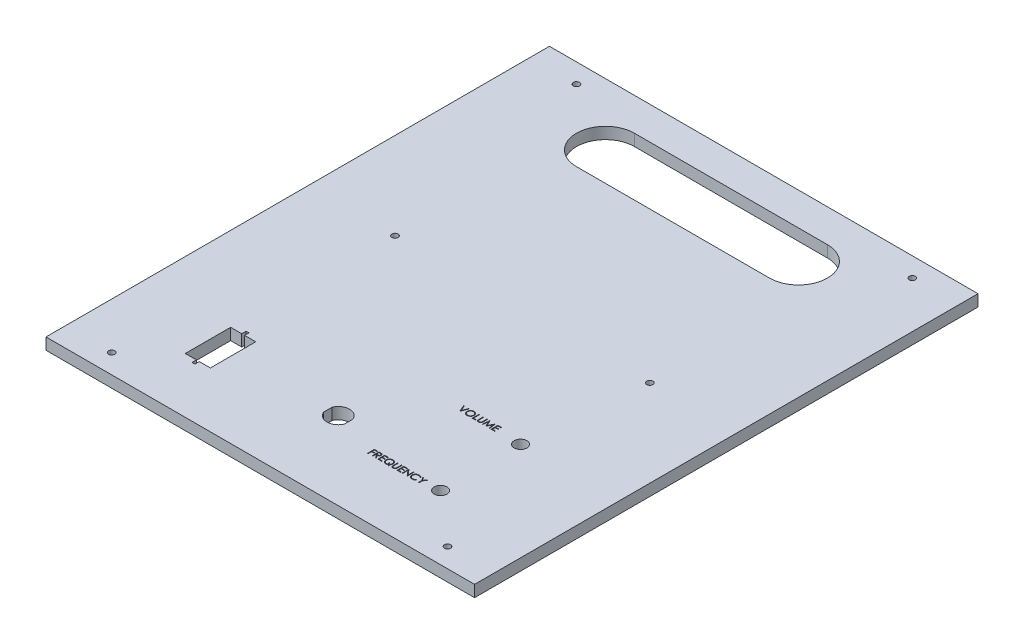
from build123d import *

# Parameters (mm, degrees)
BOSS_EXTRUDE1_DEPTH = 6
SKETCH3_R           = 1.6
SKETCH3_W           = 222
SKETCH3_H           = 30.425305758
CUT_EXTRUDE1_DEPTH  = 10
SKETCH4_R           = 1.6
CUT_EXTRUDE2_DEPTH  = 10
CUT_EXTRUDE3_DEPTH  = 10
SKETCH6_R           = 3.3
CUT_EXTRUDE4_DEPTH  = 10
CUT_EXTRUDE5_DEPTH  = 1
CUT_EXTRUDE6_DEPTH  = 10
SKETCH12_W          = 13
SKETCH12_H          = 23.5
CUT_EXTRUDE7_DEPTH  = 10
SKETCH13_W          = 1.5
SKETCH13_H          = 28
CUT_EXTRUDE8_DEPTH  = 10


with BuildPart() as part:
    # Sketch1 → Boss-Extrude1 (new body)
    with BuildSketch(Plane(origin=(0, 0, 0), x_dir=(1, 0, 0), z_dir=(0, 1, 0))):
        Polygon((-111, 125.612652879), (111, 125.612652879), (111, -125.612652879), (111, -165.612652879), (-111, -165.612652879), (-111, -125.612652879), align=None)
    extrude(amount=BOSS_EXTRUDE1_DEPTH)

    # Sketch3 → Cut-Extrude1 (cut)
    with BuildSketch(Plane.XZ):
        with Locations(Location((-66, 29.812652879, 0), (0, 0, 270))):
            Circle(SKETCH3_R)
        with Locations(Location((66, 29.812652879, 0), (0, 0, 270))):
            Circle(SKETCH3_R)
        with Locations((0, -110.4)):
            Rectangle(SKETCH3_W, SKETCH3_H)
    extrude(amount=-CUT_EXTRUDE1_DEPTH, mode=Mode.SUBTRACT)

    # Sketch4 → Cut-Extrude2 (cut)
    with BuildSketch(Plane.XZ):
        with Locations(Location((87, 155.612652879, 0), (0, 0, 270))):
            Circle(SKETCH4_R)
        with Locations(Location((-87, 155.612652879, 0), (0, 0, 270))):
            Circle(SKETCH4_R)
        with Locations(Location((-87, -85.187347121, 0), (0, 0, 270))):
            Circle(SKETCH4_R)
        with Locations(Location((87, -85.187347121, 0), (0, 0, 270))):
            Circle(SKETCH4_R)
    extrude(amount=-CUT_EXTRUDE2_DEPTH, mode=Mode.SUBTRACT)

    # Sketch5 → Cut-Extrude3 (cut)
    with BuildSketch(Plane(origin=(0, 0, 0), x_dir=(-1, 0, 0), z_dir=(0, -1, 0))):
        with BuildLine():
            Line((-5.375, -123.020074488), (-5.375, -127.40523127))
            ThreePointArc((-5.375, -127.40523127), (0, -131.017652879), (5.375, -127.40523127))
            Line((5.375, -127.40523127), (5.375, -123.020074488))
            ThreePointArc((5.375, -123.020074488), (0, -119.407652879), (-5.375, -123.020074488))
        make_face()
    extrude(amount=-CUT_EXTRUDE3_DEPTH, mode=Mode.SUBTRACT)

    # Sketch6 → Cut-Extrude4 (cut)
    with BuildSketch(Plane.XZ):
        with Locations(Location((60.087916792, 90.868161769, 0), (0, 0, 270))):
            Circle(SKETCH6_R)
        with Locations(Location((60.087916792, 132.307451464, 0), (0, 0, 270))):
            Circle(SKETCH6_R)
    extrude(amount=-CUT_EXTRUDE4_DEPTH, mode=Mode.SUBTRACT)

    # Sketch10 → Cut-Extrude5 (cut)
    # profile 1 of 15: a face of its own
    with BuildSketch(Plane(origin=(0, 6, 0), x_dir=(1, 0, 0), z_dir=(0, 1, 0))):
        Polygon((27.998808243, -88.209916027), (28.335346705, -88.209916027), (29.502013372, -90.968129168), (30.668680038, -88.209916027), (31.0052185, -88.209916027), (29.524449269, -91.709916027), (29.479577474, -91.709916027), align=None)
    # profile 2 of 15: a face of its own
    with BuildSketch(Plane(origin=(0, 6, 0), x_dir=(1, 0, 0), z_dir=(0, 1, 0))):
        with BuildLine():
            add(Edge.make_bspline(
                [(33.271244141, -88.120172438), (33.336052247, -88.121813917), (33.463340714, -88.125037918), (33.650415611, -88.149717021), (33.829010707, -88.192412411), (34.000580846, -88.249275394), (34.163073822, -88.325129779), (34.317712715, -88.416814928), (34.464129588, -88.525291386), (34.60035097, -88.649720613), (34.72500792, -88.785104067), (34.834833807, -88.929581977), (34.9268761, -89.08228078), (35.002461887, -89.24274161), (35.061760497, -89.410601578), (35.102679541, -89.586755581), (35.128817691, -89.770062271), (35.131873468, -89.895089136), (35.133423628, -89.958513784)],
                knots=[0, 0, 0, 0, 1.065120563, 2.091984664, 3.0946048, 4.079830382, 5.057816894, 6.036188127, 7.030412546, 8.04752943, 9.064399622, 10.05169764, 11.02544977, 11.989514704, 12.962713494, 13.945757189, 14.957906945, 16, 16, 16, 16], degree=3))
            add(Edge.make_bspline(
                [(35.133423628, -89.958513784), (35.131873696, -90.02147123), (35.128818599, -90.145567651), (35.102649821, -90.327711095), (35.061608821, -90.502801791), (35.003012555, -90.670547444), (34.927787077, -90.831125008), (34.835131906, -90.984111962), (34.725990695, -91.12955846), (34.601783844, -91.265871125), (34.466382802, -91.390868596), (34.321152535, -91.499787472), (34.169359215, -91.593511596), (34.009049507, -91.66829527), (33.84234947, -91.728067191), (33.667767147, -91.768819821), (33.486120593, -91.795106864), (33.362249589, -91.79812538), (33.299289013, -91.799659617)],
                knots=[0, 0, 0, 0, 1.043624062, 2.057103931, 3.04512605, 4.022047818, 4.998200453, 5.980619268, 6.982898556, 8.009068085, 9.034988726, 10.034168286, 11.015286542, 11.987931943, 12.962482838, 13.94673481, 14.956375938, 16, 16, 16, 16], degree=3))
            add(Edge.make_bspline(
                [(33.299289013, -91.799659617), (33.235864694, -91.79811023), (33.110838478, -91.795055976), (32.927301442, -91.768874572), (32.751023699, -91.727933268), (32.582509347, -91.669423831), (32.421664418, -91.593806601), (32.268174335, -91.501602222), (32.122655188, -91.392195081), (31.986313441, -91.268028506), (31.861564243, -91.132856954), (31.752804867, -90.988022699), (31.660579754, -90.836367242), (31.585216422, -90.677469718), (31.525551962, -90.512098275), (31.484847144, -90.339149798), (31.458511192, -90.159610292), (31.455476346, -90.037367394), (31.453936449, -89.975340707)],
                knots=[0, 0, 0, 0, 1.053102029, 2.075944431, 3.073151272, 4.055350789, 5.033113405, 6.020478099, 7.024410459, 8.052272461, 9.079885166, 10.07527673, 11.055994387, 12.023226415, 12.992069828, 13.970394897, 14.97016774, 16, 16, 16, 16], degree=3))
            add(Edge.make_bspline(
                [(31.453936449, -89.975340707), (31.454471084, -89.933708038), (31.45553361, -89.850967914), (31.468325303, -89.728101314), (31.486887004, -89.607210656), (31.513488917, -89.488639708), (31.548280584, -89.372678724), (31.589332611, -89.258527961), (31.639472456, -89.147344237), (31.696153104, -89.038600845), (31.759414912, -88.933992939), (31.829290662, -88.835113356), (31.90332603, -88.74113236), (31.984489424, -88.654485356), (32.070105869, -88.572651699), (32.161564247, -88.496888982), (32.258306492, -88.426514031), (32.360748871, -88.36309369), (32.466367146, -88.305734556), (32.575243924, -88.256512705), (32.685900496, -88.214266643), (32.798855144, -88.180025818), (32.913807916, -88.152993782), (33.0310097, -88.134586428), (33.150367126, -88.12176211), (33.230778445, -88.120704608), (33.271244141, -88.120172438)],
                knots=[0, 0, 0, 0, 1.037015668, 2.060948919, 3.074880161, 4.083647147, 5.086022904, 6.090072063, 7.104153813, 8.122640571, 9.144368836, 10.147691507, 11.138137339, 12.123020368, 13.103399296, 14.087645067, 15.080126199, 16.082011238, 17.087798457, 18.072939717, 19.057185487, 20.037253025, 21.01195951, 21.997135196, 22.992090687, 24, 24, 24, 24], degree=3))
        make_face()
        with BuildLine():
            add(Edge.make_bspline(
                [(33.28666882, -88.479146797), (33.253454187, -88.479551687), (33.187342454, -88.480357597), (33.089057918, -88.490973312), (32.992065984, -88.506103201), (32.896346622, -88.527684722), (32.802300332, -88.557088775), (32.709050491, -88.590929683), (32.617447437, -88.632150773), (32.527793579, -88.678723478), (32.440878504, -88.730272399), (32.358865803, -88.787244166), (32.281543159, -88.84830272), (32.209099892, -88.913590557), (32.14174872, -88.983440159), (32.078164019, -89.056792595), (32.020894437, -89.135744486), (31.96840886, -89.218154893), (31.92144102, -89.303916474), (31.879675665, -89.392126337), (31.845511656, -89.483504023), (31.81764928, -89.577058181), (31.794549469, -89.672640641), (31.779915545, -89.770976489), (31.769183186, -89.871571601), (31.76842334, -89.939553455), (31.768039013, -89.973938463)],
                knots=[0, 0, 0, 0, 1.008559885, 2.007477868, 2.99961109, 3.989939068, 4.984837346, 5.991145699, 7.001802488, 8.033829008, 9.059044045, 10.069351652, 11.065060232, 12.050310815, 13.029377138, 14.011219647, 14.996725999, 15.989392538, 16.977580475, 17.965360261, 18.951710183, 19.937753436, 20.929683414, 21.935841486, 22.955955122, 24, 24, 24, 24], degree=3))
            add(Edge.make_bspline(
                [(31.768039013, -89.973938463), (31.769313875, -90.024500684), (31.771821922, -90.123972214), (31.793779493, -90.269740358), (31.827601467, -90.409828645), (31.877458833, -90.543470554), (31.939809448, -90.671814837), (32.016836338, -90.793722941), (32.108095424, -90.909227816), (32.211758951, -91.017523085), (32.325081657, -91.116368889), (32.445414387, -91.203132298), (32.571467995, -91.276542547), (32.703571197, -91.33634762), (32.841018736, -91.383737358), (32.984696287, -91.416215989), (33.133646747, -91.437591444), (33.235177402, -91.4396442), (33.28666882, -91.440685258)],
                knots=[0, 0, 0, 0, 1.032063989, 2.030389145, 3.003944642, 3.970395727, 4.937377036, 5.913328081, 6.909231446, 7.93887556, 8.970685674, 9.976071282, 10.964166581, 11.944589148, 12.933237628, 13.927779006, 14.949070134, 16, 16, 16, 16], degree=3))
            add(Edge.make_bspline(
                [(33.28666882, -91.440685258), (33.321278322, -91.440209754), (33.389919358, -91.439266686), (33.492014881, -91.429768009), (33.592271092, -91.41453614), (33.690547372, -91.392605484), (33.786732184, -91.365158277), (33.881226987, -91.33255055), (33.973025277, -91.291869346), (34.063285115, -91.246921394), (34.149681357, -91.195681237), (34.232156889, -91.140643087), (34.308632869, -91.079674466), (34.38102194, -91.015356654), (34.448649629, -90.946392806), (34.511058613, -90.872872584), (34.568038746, -90.794331927), (34.620504392, -90.712046521), (34.667307655, -90.626050268), (34.708086754, -90.537520591), (34.74268287, -90.446675481), (34.770611375, -90.35338391), (34.792496836, -90.257823061), (34.807576756, -90.159864983), (34.818125195, -90.05970564), (34.818920272, -89.991961784), (34.819321064, -89.957812662)],
                knots=[0, 0, 0, 0, 1.047197238, 2.076906641, 3.100256066, 4.114471768, 5.12198147, 6.126382909, 7.136867548, 8.15857795, 9.17633901, 10.174870724, 11.156907918, 12.133735059, 13.104061851, 14.077631395, 15.04955518, 16.038496417, 17.029181396, 18.010275684, 18.986308667, 19.968651475, 20.955262928, 21.950658345, 22.966943676, 24, 24, 24, 24], degree=3))
            add(Edge.make_bspline(
                [(34.819321064, -89.957812662), (34.818919951, -89.923897158), (34.818124269, -89.856619508), (34.807581795, -89.757158689), (34.792480905, -89.659905478), (34.770718196, -89.565241675), (34.742668043, -89.47314315), (34.708080712, -89.383696402), (34.667295413, -89.296568207), (34.620487188, -89.21197391), (34.567871365, -89.130799172), (34.510377122, -89.053196759), (34.447011774, -88.980624018), (34.379585749, -88.911289324), (34.306414863, -88.846671434), (34.227830569, -88.786748914), (34.144786892, -88.730075639), (34.056859656, -88.678950078), (33.966115702, -88.631735845), (33.873001744, -88.591284842), (33.778572645, -88.556912722), (33.683068532, -88.527595757), (33.585685554, -88.506187727), (33.487081725, -88.490959677), (33.387393467, -88.480361291), (33.320350247, -88.479552913), (33.28666882, -88.479146797)],
                knots=[0, 0, 0, 0, 1.02996197, 2.043119294, 3.035359645, 4.018872909, 4.991431989, 5.957985074, 6.929999688, 7.912076566, 8.892894881, 9.867085534, 10.843653904, 11.817741046, 12.803660682, 13.806313499, 14.818574707, 15.856120519, 16.894564902, 17.924820532, 18.937903209, 19.946497019, 20.957711757, 21.963978472, 22.977135795, 24, 24, 24, 24], degree=3))
        make_face(mode=Mode.SUBTRACT)
    # profile 3 of 15: a face of its own
    with BuildSketch(Plane(origin=(0, 6, 0), x_dir=(1, 0, 0), z_dir=(0, 1, 0))):
        Polygon((35.851372346, -88.209916027), (36.16547491, -88.209916027), (36.16547491, -91.350941668), (37.511628756, -91.350941668), (37.511628756, -91.709916027), (35.851372346, -91.709916027), align=None)
    # profile 4 of 15: a face of its own
    with BuildSketch(Plane(origin=(0, 6, 0), x_dir=(1, 0, 0), z_dir=(0, 1, 0))):
        with BuildLine():
            Line((38.09496209, -88.209916027), (38.409064654, -88.209916027))
            Line((38.409064654, -88.209916027), (38.409064654, -90.306971316))
            add(Edge.make_bspline(
                [(38.409064654, -90.306971316), (38.40901791, -90.336652052), (38.408929205, -90.392976363), (38.409521719, -90.473144663), (38.411181087, -90.544417122), (38.412227247, -90.60706847), (38.41455458, -90.660811217), (38.416452627, -90.705936528), (38.418893184, -90.74223073), (38.421826301, -90.763411656), (38.42308709, -90.772516188)],
                knots=[0, 0, 0, 0, 1.528628734, 2.90083645, 4.128790002, 5.200304208, 6.127813768, 6.898992206, 7.526736466, 8, 8, 8, 8], degree=3))
            add(Edge.make_bspline(
                [(38.42308709, -90.772516188), (38.428264548, -90.805362951), (38.438327735, -90.86920568), (38.463974113, -90.960113962), (38.499791614, -91.04204542), (38.542234656, -91.117556711), (38.598167268, -91.184546071), (38.665170803, -91.246257724), (38.746348571, -91.300229529), (38.836609177, -91.349580341), (38.933894415, -91.389245423), (39.033305681, -91.419238787), (39.13334866, -91.437517687), (39.200324825, -91.439634226), (39.233583884, -91.440685258)],
                knots=[0, 0, 0, 0, 1.035780045, 2.013197591, 2.933192213, 3.817615948, 4.702609284, 5.640816605, 6.646850145, 7.73207398, 8.84249596, 9.914020372, 10.964143139, 12, 12, 12, 12], degree=3))
            add(Edge.make_bspline(
                [(39.233583884, -91.440685258), (39.262137625, -91.439611408), (39.319080187, -91.43746991), (39.403686617, -91.424208479), (39.486086726, -91.400307913), (39.566687406, -91.369468154), (39.64223839, -91.328720563), (39.712781832, -91.281649724), (39.775745767, -91.226438848), (39.833203764, -91.165338503), (39.8832387, -91.096398703), (39.926609842, -91.021120565), (39.962135772, -90.938371218), (39.979679296, -90.880216796), (39.988692058, -90.850340707)],
                knots=[0, 0, 0, 0, 0.994687771, 1.983630487, 2.973142513, 3.978332533, 4.983357753, 5.956394766, 6.925816176, 7.893390482, 8.871859704, 9.88551698, 10.913711441, 12, 12, 12, 12], degree=3))
            add(Edge.make_bspline(
                [(39.988692058, -90.850340707), (39.991692183, -90.837992132), (39.998377671, -90.810474532), (40.004624716, -90.763953242), (40.011131241, -90.709063878), (40.015645811, -90.645412065), (40.020047032, -90.573211092), (40.022680105, -90.492084835), (40.023897138, -90.402327874), (40.024259818, -90.339690712), (40.024449269, -90.306971316)],
                knots=[0, 0, 0, 0, 0.558680831, 1.244966039, 2.062412453, 2.990489873, 4.051219941, 5.244515665, 6.560634259, 8, 8, 8, 8], degree=3))
            Line((40.024449269, -90.306971316), (40.024449269, -88.209916027))
            Line((40.024449269, -88.209916027), (40.338551833, -88.209916027))
            Line((40.338551833, -88.209916027), (40.338551833, -90.323798239))
            add(Edge.make_bspline(
                [(40.338551833, -90.323798239), (40.338297713, -90.361896618), (40.337801781, -90.436247921), (40.333501205, -90.54519928), (40.326644205, -90.648552261), (40.316956117, -90.746320758), (40.304119114, -90.838154917), (40.289843893, -90.924859685), (40.27166436, -91.005812678), (40.250430959, -91.081645095), (40.226157411, -91.153830609), (40.194716263, -91.222339223), (40.159291763, -91.289253623), (40.11727711, -91.353561732), (40.070065727, -91.415548285), (40.016614047, -91.47483736), (39.958689886, -91.532376406), (39.895330326, -91.586689472), (39.827579801, -91.636498149), (39.755639843, -91.68029592), (39.680063073, -91.717319538), (39.601045947, -91.747795462), (39.518554744, -91.770710062), (39.432587385, -91.787785217), (39.342948191, -91.797487515), (39.281983535, -91.798929445), (39.251111929, -91.799659617)],
                knots=[0, 0, 0, 0, 1.316592851, 2.569410997, 3.76748051, 4.895814652, 5.963796859, 6.97159953, 7.931736103, 8.829262218, 9.692595152, 10.560224239, 11.431080259, 12.30701507, 13.211635791, 14.121146779, 15.063487852, 16.031507147, 17.00238618, 17.966455255, 18.938106653, 19.907068911, 20.888905087, 21.893141452, 22.933117798, 24, 24, 24, 24], degree=3))
            add(Edge.make_bspline(
                [(39.251111929, -91.799659617), (39.217442827, -91.798874852), (39.151384168, -91.797335145), (39.054046101, -91.788512395), (38.960731904, -91.771894001), (38.870456027, -91.750734057), (38.78444753, -91.72155032), (38.701554086, -91.687452195), (38.623195405, -91.645574935), (38.548100276, -91.598981542), (38.47827552, -91.546556903), (38.414178117, -91.489416729), (38.355702246, -91.428476352), (38.30383355, -91.363075986), (38.257712665, -91.293724279), (38.217982452, -91.220225039), (38.183869208, -91.142606723), (38.166262641, -91.088653523), (38.157361929, -91.061378367)],
                knots=[0, 0, 0, 0, 1.13879206, 2.234305948, 3.301075583, 4.341971843, 5.366689343, 6.369221514, 7.369726634, 8.367512178, 9.355451585, 10.318319045, 11.268648973, 12.207971039, 13.137398894, 14.081662264, 15.030215811, 16, 16, 16, 16], degree=3))
            add(Edge.make_bspline(
                [(38.157361929, -91.061378367), (38.152184771, -91.042745793), (38.1409554, -91.002331324), (38.128930102, -90.935444835), (38.118821021, -90.858429918), (38.109315462, -90.771281299), (38.103706504, -90.673931433), (38.098789066, -90.566422517), (38.094927447, -90.448624555), (38.094950219, -90.366570039), (38.09496209, -90.323798239)],
                knots=[0, 0, 0, 0, 0.625038921, 1.35572334, 2.194682327, 3.136881307, 4.189498639, 5.346923369, 6.617055217, 8, 8, 8, 8], degree=3))
            Line((38.09496209, -90.323798239), (38.09496209, -88.209916027))
        make_face()
    # profile 5 of 15: a face of its own
    with BuildSketch(Plane(origin=(0, 6, 0), x_dir=(1, 0, 0), z_dir=(0, 1, 0))):
        Polygon((41.056500551, -91.709916027), (41.518539814, -88.209916027), (41.563411609, -88.209916027), (43.008423628, -91.081710899), (44.449930038, -88.209916027), (44.495502955, -88.209916027), (44.960346705, -91.709916027), (44.644841897, -91.709916027), (44.309705679, -89.19148654), (43.046284205, -91.709916027), (42.975470904, -91.709916027), (41.707141577, -89.185877566), (41.372706481, -91.709916027), align=None)
    # profile 6 of 15: a face of its own
    with BuildSketch(Plane(origin=(0, 6, 0), x_dir=(1, 0, 0), z_dir=(0, 1, 0))):
        Polygon((45.678295423, -88.209916027), (47.652654397, -88.209916027), (47.652654397, -88.568890386), (45.992397987, -88.568890386), (45.992397987, -89.645813463), (47.652654397, -89.645813463), (47.652654397, -90.004787822), (45.992397987, -90.004787822), (45.992397987, -91.350941668), (47.652654397, -91.350941668), (47.652654397, -91.709916027), (45.678295423, -91.709916027), align=None)
    # profile 7 of 15: a face of its own
    with BuildSketch(Plane(origin=(0, 6, 0), x_dir=(1, 0, 0), z_dir=(0, 1, 0))):
        Polygon((24.47349917, -130.972883793), (26.178627375, -130.972883793), (26.178627375, -131.331858152), (24.787601734, -131.331858152), (24.787601734, -132.408781229), (26.178627375, -132.408781229), (26.178627375, -132.767755588), (24.787601734, -132.767755588), (24.787601734, -134.472883793), (24.47349917, -134.472883793), align=None)
    # profile 8 of 15: a face of its own
    with BuildSketch(Plane(origin=(0, 6, 0), x_dir=(1, 0, 0), z_dir=(0, 1, 0))):
        with BuildLine():
            Line((26.806832503, -130.972883793), (27.507253176, -130.972883793))
            add(Edge.make_bspline(
                [(27.507253176, -130.972883793), (27.553994305, -130.973039379), (27.643742449, -130.973338121), (27.77231572, -130.975003884), (27.889142817, -130.97977824), (27.994162656, -130.983886823), (28.087373311, -130.991378764), (28.169060602, -130.998539412), (28.238848299, -131.007913072), (28.28109415, -131.016618495), (28.300221926, -131.020560075)],
                knots=[0, 0, 0, 0, 1.410062039, 2.707475311, 3.878576406, 4.937260626, 5.877586885, 6.699081471, 7.410979367, 8, 8, 8, 8], degree=3))
            add(Edge.make_bspline(
                [(28.300221926, -131.020560075), (28.32582855, -131.02688684), (28.37649554, -131.039405404), (28.449445606, -131.065865005), (28.51895993, -131.096484629), (28.584749754, -131.13244835), (28.646485545, -131.174023129), (28.704803856, -131.220491252), (28.75996932, -131.271598457), (28.80975095, -131.328633299), (28.856690001, -131.388469809), (28.896278628, -131.453173565), (28.930405108, -131.520835093), (28.957575625, -131.592142511), (28.979453598, -131.666404283), (28.994879837, -131.744293079), (29.004131025, -131.825454054), (29.005072881, -131.880811963), (29.005550452, -131.908881389)],
                knots=[0, 0, 0, 0, 1.027469482, 2.033020251, 3.019912614, 3.986113645, 4.951240523, 5.91722682, 6.890402269, 7.87763091, 8.8651537, 9.85103654, 10.82876324, 11.815024772, 12.821070561, 13.842952187, 14.906261191, 16, 16, 16, 16], degree=3))
            add(Edge.make_bspline(
                [(29.005550452, -131.908881389), (29.004081454, -131.955516494), (29.001215058, -132.046513661), (28.974489954, -132.178574543), (28.930713435, -132.301763857), (28.870390146, -132.415926495), (28.79357067, -132.518837141), (28.701245879, -132.609227596), (28.593364267, -132.684867509), (28.492934951, -132.737320313), (28.404220752, -132.770913222), (28.331187439, -132.794549581), (28.251520461, -132.812811546), (28.165983127, -132.829171678), (28.074219471, -132.841523372), (27.976449432, -132.850569967), (27.87260328, -132.856224015), (27.801264211, -132.85706602), (27.764564875, -132.857499177)],
                knots=[0, 0, 0, 0, 1.260483769, 2.459530307, 3.627416485, 4.787058657, 5.939039949, 7.08810263, 8.267026773, 9.491475466, 10.141966685, 10.831826277, 11.566392101, 12.351337768, 13.187381173, 14.07005841, 15.007169909, 16, 16, 16, 16], degree=3))
            Line((27.764564875, -132.857499177), (29.050422247, -134.472883793))
            Line((29.050422247, -134.472883793), (28.662000772, -134.472883793))
            Line((28.662000772, -134.472883793), (27.376143401, -132.857499177))
            Line((27.376143401, -132.857499177), (27.120935067, -132.857499177))
            Line((27.120935067, -132.857499177), (27.120935067, -134.472883793))
            Line((27.120935067, -134.472883793), (26.806832503, -134.472883793))
            Line((26.806832503, -134.472883793), (26.806832503, -130.972883793))
        make_face()
        with BuildLine():
            Line((27.120935067, -131.331858152), (27.120935067, -132.498524818))
            Line((27.120935067, -132.498524818), (27.761760388, -132.503432671))
            add(Edge.make_bspline(
                [(27.761760388, -132.503432671), (27.791680427, -132.503445908), (27.849673984, -132.503471564), (27.933574649, -132.499477788), (28.01169476, -132.49493447), (28.083735513, -132.487985124), (28.149729088, -132.479029052), (28.209642501, -132.467826068), (28.263573553, -132.454774005), (28.326472091, -132.43457238), (28.396708623, -132.402566361), (28.473040083, -132.356000863), (28.53804242, -132.297431743), (28.592960283, -132.230458287), (28.637089714, -132.156822039), (28.668201768, -132.077405669), (28.687944211, -131.994214071), (28.690272756, -131.937035964), (28.691447888, -131.908180267)],
                knots=[0, 0, 0, 0, 1.146690395, 2.22261258, 3.21895312, 4.145990853, 4.996080663, 5.770904154, 6.481378293, 7.121626537, 8.300444488, 9.431385265, 10.535395872, 11.636531494, 12.74115979, 13.810798291, 14.895190096, 16, 16, 16, 16], degree=3))
            add(Edge.make_bspline(
                [(28.691447888, -131.908180267), (28.690245767, -131.880033693), (28.687863601, -131.824257455), (28.668414833, -131.742601544), (28.635525451, -131.665534594), (28.591203214, -131.593370109), (28.537204059, -131.527864373), (28.473886246, -131.47181722), (28.402981051, -131.425567756), (28.336709852, -131.396013375), (28.27747564, -131.377893522), (28.22604598, -131.365142358), (28.167934502, -131.354897889), (28.102859044, -131.346689828), (28.031097413, -131.339634884), (27.952286762, -131.334883105), (27.866949981, -131.332069241), (27.80780305, -131.331930152), (27.777185067, -131.331858152)],
                knots=[0, 0, 0, 0, 1.101028733, 2.181837193, 3.264309656, 4.369019818, 5.486613113, 6.575447106, 7.666700264, 8.788928104, 9.402425223, 10.0903467, 10.862060571, 11.710948788, 12.657782767, 13.684531032, 14.801375019, 16, 16, 16, 16], degree=3))
            Line((27.777185067, -131.331858152), (27.120935067, -131.331858152))
        make_face(mode=Mode.SUBTRACT)
    # profile 9 of 15: a face of its own
    with BuildSketch(Plane(origin=(0, 6, 0), x_dir=(1, 0, 0), z_dir=(0, 1, 0))):
        Polygon((29.768370965, -130.972883793), (31.742729939, -130.972883793), (31.742729939, -131.331858152), (30.082473529, -131.331858152), (30.082473529, -132.408781229), (31.742729939, -132.408781229), (31.742729939, -132.767755588), (30.082473529, -132.767755588), (30.082473529, -134.113909434), (31.742729939, -134.113909434), (31.742729939, -134.472883793), (29.768370965, -134.472883793), align=None)
    # profile 10 of 15: a face of its own
    with BuildSketch(Plane(origin=(0, 6, 0), x_dir=(1, 0, 0), z_dir=(0, 1, 0))):
        with BuildLine():
            Line((35.288302856, -134.083060075), (35.826063272, -134.742114562))
            Line((35.826063272, -134.742114562), (35.434136189, -134.742114562))
            Line((35.434136189, -134.742114562), (35.045714715, -134.266753985))
            add(Edge.make_bspline(
                [(35.045714715, -134.266753985), (35.006757622, -134.290427721), (34.929561058, -134.337339103), (34.80919442, -134.397805269), (34.68643412, -134.448121007), (34.561551777, -134.489690981), (34.434729288, -134.522965307), (34.30532355, -134.546059096), (34.173803906, -134.559469372), (34.085441504, -134.561570699), (34.041007183, -134.562627383)],
                knots=[0, 0, 0, 0, 1.030216282, 2.041455142, 3.041201647, 4.026904037, 5.014869161, 6.002481075, 6.995518502, 8, 8, 8, 8], degree=3))
            add(Edge.make_bspline(
                [(34.041007183, -134.562627383), (33.977346842, -134.561094036), (33.852082242, -134.558076867), (33.668112125, -134.53173641), (33.491528506, -134.491055891), (33.322683355, -134.432195226), (33.161392743, -134.357012744), (33.007731605, -134.264323468), (32.86162184, -134.155411253), (32.725220249, -134.030987873), (32.600494832, -133.895632567), (32.491056093, -133.751011529), (32.398003597, -133.599524569), (32.322765111, -133.440416271), (32.263053316, -133.275071784), (32.222361347, -133.102115989), (32.19602191, -132.922578468), (32.192987542, -132.800335298), (32.191447888, -132.738308472)],
                knots=[0, 0, 0, 0, 1.055750571, 2.07740284, 3.077223765, 4.05828044, 5.038417088, 6.02463293, 7.030503776, 8.057169806, 9.083586829, 10.080154041, 11.061747002, 12.027853603, 12.995569715, 13.972756451, 14.971366004, 16, 16, 16, 16], degree=3))
            add(Edge.make_bspline(
                [(32.191447888, -132.738308472), (32.19199568, -132.696677189), (32.193087417, -132.613707116), (32.205716568, -132.490819945), (32.224480359, -132.369955814), (32.251021012, -132.251616987), (32.285764941, -132.135318409), (32.327419324, -132.021289404), (32.377889155, -131.909823796), (32.434944073, -131.801149719), (32.498576673, -131.696209058), (32.567893109, -131.596495399), (32.643063905, -131.502991426), (32.724035845, -131.41573992), (32.810485554, -131.334548012), (32.901669634, -131.258078713), (32.999532311, -131.189176764), (33.101490685, -131.125100715), (33.20811653, -131.068754702), (33.317324244, -131.018383168), (33.429930762, -130.977513014), (33.544475004, -130.942686693), (33.661651898, -130.916098784), (33.781370121, -130.897472545), (33.903545451, -130.884721578), (33.986053091, -130.883670546), (34.027685869, -130.883140203)],
                knots=[0, 0, 0, 0, 1.030721839, 2.054201982, 3.056261636, 4.058906239, 5.055198403, 6.060579377, 7.06322398, 8.083343201, 9.098870418, 10.10084648, 11.0888991, 12.067804703, 13.046436456, 14.024708667, 15.012489976, 16.008294399, 17.005242112, 17.997338632, 18.984424362, 19.969624474, 20.960977749, 21.957320355, 22.969278161, 24, 24, 24, 24], degree=3))
            add(Edge.make_bspline(
                [(34.027685869, -130.883140203), (34.091346447, -130.884665851), (34.216379898, -130.887662322), (34.39989426, -130.914006751), (34.575957672, -130.954850513), (34.744444796, -131.013411209), (34.905205414, -131.088783029), (35.058171985, -131.181453622), (35.203581668, -131.290373052), (35.339270516, -131.414804763), (35.463702182, -131.550493604), (35.572621783, -131.695903268), (35.665291751, -131.848869921), (35.740665883, -132.009630233), (35.799217876, -132.178118508), (35.840147302, -132.354403332), (35.866365941, -132.538170251), (35.86939545, -132.663431756), (35.870935067, -132.727090524)],
                knots=[0, 0, 0, 0, 1.050672203, 2.063587442, 3.054842799, 4.031180399, 5.003107577, 5.981273811, 6.979214548, 7.998088659, 9.016962771, 10.014903508, 10.993069742, 11.96499692, 12.941334519, 13.932589877, 14.949327797, 16, 16, 16, 16], degree=3))
            add(Edge.make_bspline(
                [(35.870935067, -132.727090524), (35.869252449, -132.79332789), (35.865943676, -132.92357992), (35.837785448, -133.114580646), (35.792511961, -133.297031332), (35.728308689, -133.470812437), (35.645308368, -133.635892375), (35.545114501, -133.793921959), (35.426520746, -133.944889987), (35.334860691, -134.036518342), (35.288302856, -134.083060075)],
                knots=[0, 0, 0, 0, 1.045660934, 2.056233022, 3.041853582, 4.009978652, 4.97562384, 5.954545411, 6.961031197, 8, 8, 8, 8], degree=3))
        make_face()
        with BuildLine():
            add(Edge.make_bspline(
                [(35.077265196, -133.824346133), (35.115453876, -133.785563159), (35.190572705, -133.709275332), (35.288037908, -133.584167331), (35.37186776, -133.454120099), (35.438982683, -133.317403699), (35.492381754, -133.175730986), (35.529274648, -133.027979401), (35.552374729, -132.874821579), (35.555335653, -132.770642224), (35.556832503, -132.71797594)],
                knots=[0, 0, 0, 0, 1.052210109, 2.069743939, 3.061837814, 4.040478349, 5.010453814, 5.985306305, 6.981502329, 8, 8, 8, 8], degree=3))
            add(Edge.make_bspline(
                [(35.556832503, -132.71797594), (35.556441399, -132.684059507), (35.555668254, -132.617012697), (35.54503753, -132.51779518), (35.529998216, -132.420769011), (35.508225901, -132.326107549), (35.480188508, -132.234002582), (35.445559865, -132.144579145), (35.405014656, -132.057548749), (35.357747801, -131.973452025), (35.305640093, -131.892410861), (35.247637822, -131.81541635), (35.184557402, -131.7428655), (35.117087959, -131.673562705), (35.043928681, -131.608936552), (34.965341946, -131.549014743), (34.88229612, -131.492347188), (34.794380258, -131.441197404), (34.703782989, -131.394173159), (34.611034431, -131.353453074), (34.516913366, -131.31896462), (34.421565546, -131.290998913), (34.32511435, -131.268986341), (34.227390682, -131.253963856), (34.128647253, -131.243344078), (34.062302784, -131.24252475), (34.029088112, -131.242114562)],
                knots=[0, 0, 0, 0, 1.032958288, 2.041976502, 3.037103433, 4.023477888, 4.998866292, 5.968231228, 6.943073582, 7.921783703, 8.90545537, 9.876780072, 10.85618943, 11.833110341, 12.821898168, 13.827467856, 14.842673888, 15.88323808, 16.924703457, 17.951432745, 18.967462636, 19.976958182, 20.977218729, 21.979378626, 22.98839684, 24, 24, 24, 24], degree=3))
            add(Edge.make_bspline(
                [(34.029088112, -131.242114562), (33.995640351, -131.242527612), (33.928830743, -131.243352652), (33.829610597, -131.253905119), (33.731662652, -131.269002878), (33.635417703, -131.290906046), (33.540534911, -131.318926138), (33.447308786, -131.353623093), (33.354928585, -131.39333741), (33.265311283, -131.440331629), (33.178613678, -131.491921251), (33.09615877, -131.548025346), (33.019076545, -131.609203666), (32.946635803, -131.674471246), (32.879017478, -131.744331673), (32.815902309, -131.81832024), (32.758398709, -131.89729544), (32.705714594, -131.979844282), (32.659149874, -132.066056454), (32.617154406, -132.154376484), (32.583044756, -132.245778088), (32.555041458, -132.339529689), (32.532158524, -132.435398215), (32.517409586, -132.533940178), (32.506699119, -132.63454042), (32.505936289, -132.702521575), (32.505550452, -132.736906229)],
                knots=[0, 0, 0, 0, 1.013205451, 2.023808328, 3.020541854, 4.015386314, 5.012622987, 6.016502547, 7.02834558, 8.057881235, 9.080621846, 10.084476421, 11.077781791, 12.060654405, 13.037357686, 14.022218736, 15.005346502, 15.995617173, 16.98763393, 17.973029642, 18.956998942, 19.940662314, 20.93709383, 21.940823471, 22.958474994, 24, 24, 24, 24], degree=3))
            add(Edge.make_bspline(
                [(32.505550452, -132.736906229), (32.506864008, -132.78745914), (32.509448181, -132.886912356), (32.530870324, -133.032926841), (32.566787236, -133.172713331), (32.617036488, -133.306471807), (32.680117531, -133.43497323), (32.758563578, -133.556958712), (32.852039956, -133.67196363), (32.957010413, -133.78077791), (33.072479483, -133.879359289), (33.194887896, -133.966121668), (33.323190558, -134.039731858), (33.457790362, -134.09914387), (33.597683591, -134.146853726), (33.74397456, -134.179154251), (33.895706959, -134.200563908), (33.999098368, -134.202613671), (34.05152401, -134.203653024)],
                knots=[0, 0, 0, 0, 1.022526523, 2.011626, 2.97850031, 3.937665323, 4.897797383, 5.869804095, 6.865337375, 7.89202157, 8.925035373, 9.93268082, 10.923937058, 11.912550332, 12.905497077, 13.90928476, 14.939882052, 16, 16, 16, 16], degree=3))
            add(Edge.make_bspline(
                [(34.05152401, -134.203653024), (34.087542414, -134.203260653), (34.158784273, -134.202484571), (34.263838278, -134.191903953), (34.366321504, -134.177011514), (34.465284929, -134.154361574), (34.56158672, -134.126202716), (34.65465366, -134.091950008), (34.744979433, -134.051343134), (34.802412503, -134.019218319), (34.831171446, -134.00313219)],
                knots=[0, 0, 0, 0, 1.060694673, 2.097979151, 3.107774411, 4.11000626, 5.086069662, 6.061987343, 7.029562652, 8, 8, 8, 8], degree=3))
            Line((34.831171446, -134.00313219), (34.043110548, -133.036986357))
            Line((34.043110548, -133.036986357), (34.435037631, -133.036986357))
            Line((34.435037631, -133.036986357), (35.077265196, -133.824346133))
        make_face(mode=Mode.SUBTRACT)
    # profile 11 of 15: a face of its own
    with BuildSketch(Plane(origin=(0, 6, 0), x_dir=(1, 0, 0), z_dir=(0, 1, 0))):
        with BuildLine():
            Line((36.588883785, -130.972883793), (36.902986349, -130.972883793))
            Line((36.902986349, -130.972883793), (36.902986349, -133.069939081))
            add(Edge.make_bspline(
                [(36.902986349, -133.069939081), (36.902939605, -133.099619817), (36.902850901, -133.155944128), (36.903443415, -133.236112428), (36.905102783, -133.307384887), (36.906148942, -133.370036235), (36.908476276, -133.423778983), (36.910374323, -133.468904293), (36.91281488, -133.505198496), (36.915747997, -133.526379422), (36.917008785, -133.535483953)],
                knots=[0, 0, 0, 0, 1.528628734, 2.90083645, 4.128790002, 5.200304208, 6.127813768, 6.898992206, 7.526736466, 8, 8, 8, 8], degree=3))
            add(Edge.make_bspline(
                [(36.917008785, -133.535483953), (36.922186244, -133.568330716), (36.93224943, -133.632173446), (36.957895808, -133.723081727), (36.993713309, -133.805013186), (37.036156352, -133.880524477), (37.092088963, -133.947513837), (37.159092499, -134.00922549), (37.240270267, -134.063197294), (37.330530873, -134.112548106), (37.42781611, -134.152213188), (37.527227377, -134.182206553), (37.627270356, -134.200485453), (37.694246521, -134.202601991), (37.72750558, -134.203653024)],
                knots=[0, 0, 0, 0, 1.035780045, 2.013197591, 2.933192213, 3.817615948, 4.702609284, 5.640816605, 6.646850145, 7.73207398, 8.84249596, 9.914020372, 10.964143139, 12, 12, 12, 12], degree=3))
            add(Edge.make_bspline(
                [(37.72750558, -134.203653024), (37.756059321, -134.202579173), (37.813001882, -134.200437675), (37.897608313, -134.187176244), (37.980008422, -134.163275678), (38.060609102, -134.13243592), (38.136160086, -134.091688329), (38.206703528, -134.044617489), (38.269667462, -133.989406613), (38.32712546, -133.928306269), (38.377160396, -133.859366469), (38.420531538, -133.784088331), (38.456057467, -133.701338984), (38.473600992, -133.643184562), (38.482613753, -133.613308472)],
                knots=[0, 0, 0, 0, 0.994687771, 1.983630487, 2.973142513, 3.978332533, 4.983357753, 5.956394766, 6.925816176, 7.893390482, 8.871859704, 9.88551698, 10.913711441, 12, 12, 12, 12], degree=3))
            add(Edge.make_bspline(
                [(38.482613753, -133.613308472), (38.485613878, -133.600959898), (38.492299367, -133.573442298), (38.498546412, -133.526921007), (38.505052937, -133.472031643), (38.509567507, -133.40837983), (38.513968728, -133.336178858), (38.5166018, -133.2550526), (38.517818833, -133.16529564), (38.518181514, -133.102658478), (38.518370965, -133.069939081)],
                knots=[0, 0, 0, 0, 0.558680831, 1.244966039, 2.062412453, 2.990489873, 4.051219941, 5.244515665, 6.560634259, 8, 8, 8, 8], degree=3))
            Line((38.518370965, -133.069939081), (38.518370965, -130.972883793))
            Line((38.518370965, -130.972883793), (38.832473529, -130.972883793))
            Line((38.832473529, -130.972883793), (38.832473529, -133.086766004))
            add(Edge.make_bspline(
                [(38.832473529, -133.086766004), (38.832219408, -133.124864383), (38.831723477, -133.199215686), (38.827422901, -133.308167045), (38.820565901, -133.411520026), (38.810877813, -133.509288523), (38.79804081, -133.601122682), (38.783765589, -133.68782745), (38.765586056, -133.768780443), (38.744352655, -133.844612861), (38.720079107, -133.916798374), (38.688637958, -133.985306989), (38.653213459, -134.052221388), (38.611198806, -134.116529497), (38.563987423, -134.17851605), (38.510535742, -134.237805125), (38.452611581, -134.295344172), (38.389252022, -134.349657238), (38.321501496, -134.399465915), (38.249561539, -134.443263686), (38.173984769, -134.480287303), (38.094967643, -134.510763228), (38.01247644, -134.533677827), (37.92650908, -134.550752983), (37.836869887, -134.56045528), (37.775905231, -134.56189721), (37.745033625, -134.562627383)],
                knots=[0, 0, 0, 0, 1.316592851, 2.569410997, 3.76748051, 4.895814652, 5.963796859, 6.97159953, 7.931736103, 8.829262218, 9.692595152, 10.560224239, 11.431080259, 12.30701507, 13.211635791, 14.121146779, 15.063487852, 16.031507147, 17.00238618, 17.966455255, 18.938106653, 19.907068911, 20.888905087, 21.893141452, 22.933117798, 24, 24, 24, 24], degree=3))
            add(Edge.make_bspline(
                [(37.745033625, -134.562627383), (37.711364522, -134.561842617), (37.645305864, -134.560302911), (37.547967796, -134.55148016), (37.4546536, -134.534861766), (37.364377723, -134.513701822), (37.278369226, -134.484518085), (37.195475781, -134.45041996), (37.1171171, -134.4085427), (37.042021972, -134.361949307), (36.972197215, -134.309524669), (36.908099812, -134.252384495), (36.849623942, -134.191444117), (36.797755245, -134.126043752), (36.751634361, -134.056692045), (36.711904147, -133.983192805), (36.677790903, -133.905574489), (36.660184336, -133.851621288), (36.651283625, -133.824346133)],
                knots=[0, 0, 0, 0, 1.13879206, 2.234305948, 3.301075583, 4.341971843, 5.366689343, 6.369221514, 7.369726634, 8.367512178, 9.355451585, 10.318319045, 11.268648973, 12.207971039, 13.137398894, 14.081662264, 15.030215811, 16, 16, 16, 16], degree=3))
            add(Edge.make_bspline(
                [(36.651283625, -133.824346133), (36.646106467, -133.805713558), (36.634877095, -133.765299089), (36.622851798, -133.698412601), (36.612742716, -133.621397683), (36.603237158, -133.534249065), (36.5976282, -133.436899198), (36.592710761, -133.329390282), (36.588849142, -133.21159232), (36.588871915, -133.129537805), (36.588883785, -133.086766004)],
                knots=[0, 0, 0, 0, 0.625038921, 1.35572334, 2.194682327, 3.136881307, 4.189498639, 5.346923369, 6.617055217, 8, 8, 8, 8], degree=3))
            Line((36.588883785, -133.086766004), (36.588883785, -130.972883793))
        make_face()
    # profile 12 of 15: a face of its own
    with BuildSketch(Plane(origin=(0, 6, 0), x_dir=(1, 0, 0), z_dir=(0, 1, 0))):
        Polygon((39.729909426, -130.972883793), (41.704268401, -130.972883793), (41.704268401, -131.331858152), (40.04401199, -131.331858152), (40.04401199, -132.408781229), (41.704268401, -132.408781229), (41.704268401, -132.767755588), (40.04401199, -132.767755588), (40.04401199, -134.113909434), (41.704268401, -134.113909434), (41.704268401, -134.472883793), (39.729909426, -134.472883793), align=None)
    # profile 13 of 15: a face of its own
    with BuildSketch(Plane(origin=(0, 6, 0), x_dir=(1, 0, 0), z_dir=(0, 1, 0))):
        Polygon((42.332473529, -134.472883793), (42.332473529, -130.972883793), (42.398378978, -130.972883793), (44.710678657, -133.727591325), (44.710678657, -130.972883793), (45.024781221, -130.972883793), (45.024781221, -134.472883793), (44.953266798, -134.472883793), (42.646576093, -131.724486357), (42.646576093, -134.472883793), align=None)
    # profile 14 of 15: a face of its own
    with BuildSketch(Plane(origin=(0, 6, 0), x_dir=(1, 0, 0), z_dir=(0, 1, 0))):
        with BuildLine():
            Line((49.152986349, -131.615111357), (48.878146606, -131.825447895))
            add(Edge.make_bspline(
                [(48.878146606, -131.825447895), (48.858540717, -131.802081925), (48.819593271, -131.75566501), (48.756934068, -131.690485465), (48.691632425, -131.629420204), (48.623713304, -131.572178324), (48.551954184, -131.520761559), (48.478093386, -131.472490456), (48.400895341, -131.429222718), (48.294143606, -131.376759732), (48.154495758, -131.322013576), (47.978700919, -131.276110345), (47.79518982, -131.24688917), (47.66999222, -131.243724328), (47.60631167, -131.242114562)],
                knots=[0, 0, 0, 0, 0.757959112, 1.505699292, 2.245454638, 2.979532153, 3.711538275, 4.438200793, 5.171680507, 5.909471876, 7.393775596, 8.890124382, 10.418191784, 12, 12, 12, 12], degree=3))
            add(Edge.make_bspline(
                [(47.60631167, -131.242114562), (47.571228371, -131.242518525), (47.501387378, -131.2433227), (47.397738904, -131.253931826), (47.296025853, -131.268843036), (47.196314387, -131.290968359), (47.098731429, -131.318940978), (47.002639026, -131.352366392), (46.909428427, -131.393721232), (46.817810188, -131.439429492), (46.730030977, -131.491056936), (46.64697593, -131.547370288), (46.568947962, -131.607739385), (46.49588535, -131.672390491), (46.427713401, -131.741032452), (46.364926091, -131.814396793), (46.30774068, -131.892248967), (46.255023655, -131.973562374), (46.207810922, -132.058100166), (46.168281042, -132.146175236), (46.13327592, -132.236279339), (46.105576678, -132.3294305), (46.083652161, -132.424973266), (46.068524497, -132.523164054), (46.058036026, -132.623797734), (46.057235849, -132.692007046), (46.056832503, -132.726389402)],
                knots=[0, 0, 0, 0, 1.054917814, 2.100044995, 3.131103042, 4.146048494, 5.169673617, 6.183595914, 7.203665975, 8.234915748, 9.262203917, 10.264457458, 11.251630812, 12.227803204, 13.197192746, 14.159520551, 15.12972552, 16.100847026, 17.073214652, 18.039054194, 19.002613845, 19.979014051, 20.95965708, 21.949030935, 22.966165397, 24, 24, 24, 24], degree=3))
            add(Edge.make_bspline(
                [(46.056832503, -132.726389402), (46.058094322, -132.778120722), (46.060571736, -132.879688307), (46.082620071, -133.028458917), (46.116125162, -133.170979591), (46.166340739, -133.306359433), (46.228259789, -133.436267791), (46.306500401, -133.558506645), (46.397116938, -133.674923209), (46.501391358, -133.782766157), (46.615797174, -133.881279882), (46.738545085, -133.968030464), (46.869329373, -134.040345346), (47.006706003, -134.100521293), (47.151732117, -134.14677802), (47.30414692, -134.179342144), (47.463618915, -134.200584324), (47.572588315, -134.202618012), (47.628046446, -134.203653024)],
                knots=[0, 0, 0, 0, 1.029171465, 2.020641659, 2.987623507, 3.938342917, 4.889210282, 5.84687017, 6.821220943, 7.821438502, 8.827599549, 9.822697543, 10.807740252, 11.797342354, 12.80366471, 13.83203677, 14.896651826, 16, 16, 16, 16], degree=3))
            add(Edge.make_bspline(
                [(47.628046446, -134.203653024), (47.689149134, -134.201964244), (47.809413843, -134.198640321), (47.98578187, -134.170481072), (48.154617635, -134.124823154), (48.315930222, -134.060925232), (48.469264868, -133.977859944), (48.614861528, -133.877162067), (48.752843099, -133.757873734), (48.835814381, -133.666790606), (48.878146606, -133.62031969)],
                knots=[0, 0, 0, 0, 1.028121516, 2.023589091, 2.998037872, 3.967518031, 4.937445131, 5.927275754, 6.942489185, 8, 8, 8, 8], degree=3))
            Line((48.878146606, -133.62031969), (49.152986349, -133.828552863))
            add(Edge.make_bspline(
                [(49.152986349, -133.828552863), (49.130868239, -133.857091315), (49.086737964, -133.914031521), (49.015279947, -133.994303231), (48.94000265, -134.069807267), (48.86034694, -134.139934888), (48.777229148, -134.206089354), (48.689156836, -134.266391185), (48.597287803, -134.321682069), (48.501933324, -134.372308994), (48.403194712, -134.417226241), (48.301190277, -134.455680008), (48.196359701, -134.488804898), (48.088698193, -134.516056835), (47.977982436, -134.537327919), (47.864611962, -134.551547593), (47.748342087, -134.561289508), (47.669900666, -134.562177424), (47.630149811, -134.562627383)],
                knots=[0, 0, 0, 0, 0.986787822, 1.968848986, 2.935600012, 3.899624008, 4.868462664, 5.837806735, 6.815139263, 7.798259679, 8.787526145, 9.778297419, 10.776456485, 11.791383307, 12.812564526, 13.85620153, 14.913611965, 16, 16, 16, 16], degree=3))
            add(Edge.make_bspline(
                [(47.630149811, -134.562627383), (47.592506144, -134.56236539), (47.518070454, -134.561847332), (47.408171702, -134.553455165), (47.301182121, -134.542005428), (47.197407495, -134.524765297), (47.09628152, -134.504420957), (46.998720936, -134.4771497), (46.903765726, -134.446600533), (46.811797385, -134.410695547), (46.722737685, -134.370179364), (46.636873874, -134.324387805), (46.554245441, -134.273705941), (46.47404002, -134.21925093), (46.397442437, -134.159273628), (46.323788911, -134.094606994), (46.252666435, -134.025468983), (46.20866375, -133.97561413), (46.186540035, -133.950548056)],
                knots=[0, 0, 0, 0, 1.114604814, 2.203992996, 3.262667896, 4.300477797, 5.318619304, 6.316056647, 7.298880507, 8.271930387, 9.238335007, 10.195173496, 11.151986948, 12.108099108, 13.064862484, 14.031167946, 15.010108607, 16, 16, 16, 16], degree=3))
            add(Edge.make_bspline(
                [(46.186540035, -133.950548056), (46.151104392, -133.907006867), (46.080660915, -133.820450156), (45.990535231, -133.680164175), (45.913387676, -133.533695966), (45.851011755, -133.380276037), (45.802249022, -133.22024865), (45.768467827, -133.053533136), (45.746516223, -132.880285193), (45.744005934, -132.762448405), (45.742729939, -132.702551261)],
                knots=[0, 0, 0, 0, 0.994628077, 1.977248131, 2.950237994, 3.925870899, 4.908910175, 5.911660606, 6.938484602, 8, 8, 8, 8], degree=3))
            add(Edge.make_bspline(
                [(45.742729939, -132.702551261), (45.744285133, -132.639595807), (45.747344879, -132.515734883), (45.773340674, -132.333960929), (45.815159471, -132.15980953), (45.874556359, -131.993605786), (45.94986171, -131.834475506), (46.042888324, -131.683634301), (46.152555467, -131.540117501), (46.278003034, -131.40610275), (46.415570369, -131.283563397), (46.562889183, -131.175757193), (46.71967113, -131.086039677), (46.884188982, -131.011043515), (47.057674664, -130.953399052), (47.239758033, -130.913045865), (47.430096947, -130.887928749), (47.559959373, -130.884753541), (47.62594308, -130.883140203)],
                knots=[0, 0, 0, 0, 1.032925535, 2.032216505, 3.007276963, 3.968222605, 4.92396291, 5.891752235, 6.871517503, 7.883894988, 8.900124299, 9.891468569, 10.874487609, 11.85992873, 12.854644235, 13.869047385, 14.917252991, 16, 16, 16, 16], degree=3))
            add(Edge.make_bspline(
                [(47.62594308, -130.883140203), (47.666157552, -130.883622341), (47.745758049, -130.884576685), (47.863510702, -130.893882827), (47.978153029, -130.909396434), (48.089764011, -130.930512503), (48.198886627, -130.956719825), (48.304686868, -130.990860123), (48.407785555, -131.029896654), (48.507532463, -131.07485512), (48.603449013, -131.125321862), (48.695505332, -131.180737485), (48.78297019, -131.241033291), (48.866459039, -131.305696466), (48.94457525, -131.376095026), (49.019536728, -131.450292622), (49.088797806, -131.530426446), (49.131551001, -131.58683138), (49.152986349, -131.615111357)],
                knots=[0, 0, 0, 0, 1.096760587, 2.17092713, 3.219439832, 4.250915756, 5.268269357, 6.278326846, 7.281116186, 8.274029601, 9.260640565, 10.235837813, 11.203064059, 12.156899882, 13.114053108, 14.069676657, 15.032185724, 16, 16, 16, 16], degree=3))
        make_face()
    # profile 15 of 15: a face of its own
    with BuildSketch(Plane(origin=(0, 6, 0), x_dir=(1, 0, 0), z_dir=(0, 1, 0))):
        Polygon((49.601704298, -130.972883793), (49.961379779, -130.972883793), (50.881251574, -132.476790043), (51.799721125, -130.972883793), (52.159396606, -130.972883793), (51.037601734, -132.809121774), (51.037601734, -134.472883793), (50.72349917, -134.472883793), (50.72349917, -132.809121774), align=None)
    extrude(amount=-CUT_EXTRUDE5_DEPTH, mode=Mode.SUBTRACT)

    # Sketch11 → Cut-Extrude6 (cut)
    with BuildSketch(Plane(origin=(0, 6, 0), x_dir=(1, 0, 0), z_dir=(0, 1, 0))):
        with BuildLine():
            Line((-50, 78.187347121), (50, 78.187347121))
            ThreePointArc((50, 78.187347121), (65, 63.187347121), (50, 48.187347121))
            Line((50, 48.187347121), (-50, 48.187347121))
            ThreePointArc((-50, 48.187347121), (-65, 63.187347121), (-50, 78.187347121))
        make_face()
    extrude(amount=-CUT_EXTRUDE6_DEPTH, mode=Mode.SUBTRACT)

    # Sketch12 → Cut-Extrude7 (cut)
    with BuildSketch(Plane.XZ):
        with Locations((-61.001620779, 125.212652879)):
            Rectangle(SKETCH12_W, SKETCH12_H)
    extrude(amount=-CUT_EXTRUDE7_DEPTH, mode=Mode.SUBTRACT)

    # Sketch13 → Cut-Extrude8 (cut)
    with BuildSketch(Plane.XZ):
        with Locations((-61.001620779, 125.212652879)):
            Rectangle(SKETCH13_W, SKETCH13_H)
    extrude(amount=-CUT_EXTRUDE8_DEPTH, mode=Mode.SUBTRACT)


solid = part.part
